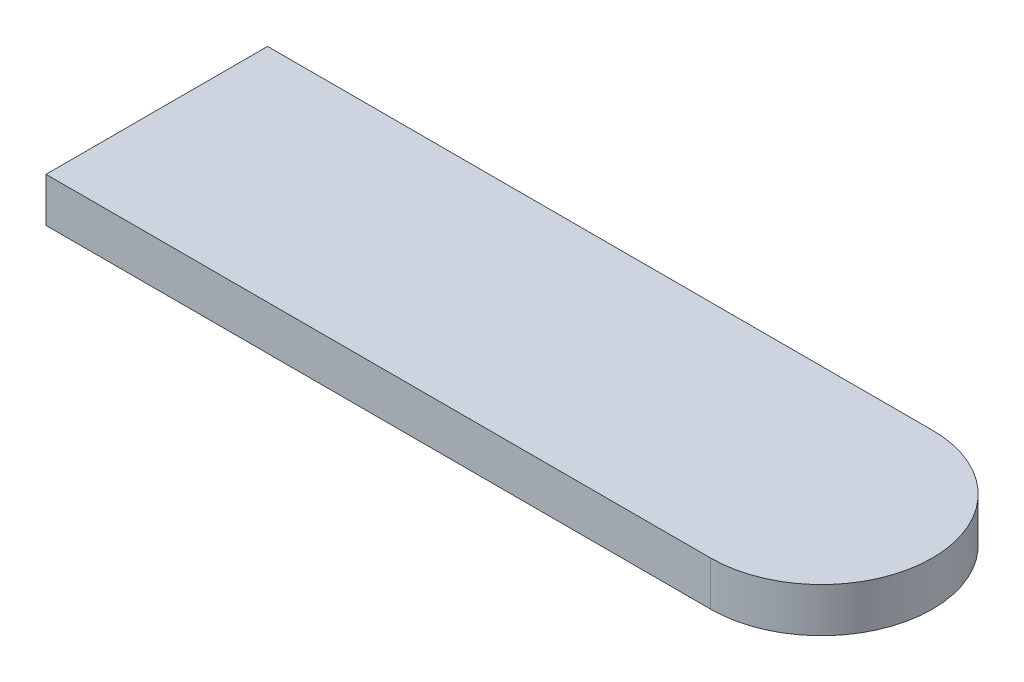
from build123d import *

# Parameters (mm, degrees)
BOSS_EXTRU_1_DEPTH = 10


with BuildPart() as part:
    # Esquisse1 → Boss.-Extru.1 (new body)
    with BuildSketch(Plane(origin=(0, 0, 0), x_dir=(1, 0, 0), z_dir=(0, 1, 0))):
        with BuildLine():
            Line((-87.5, -25), (-87.5, 25))
            Line((-87.5, 25), (62.5, 25))
            ThreePointArc((62.5, 25), (87.5, 0), (62.5, -25))
            Line((62.5, -25), (-87.5, -25))
        make_face()
    extrude(amount=BOSS_EXTRU_1_DEPTH)


solid = part.part
